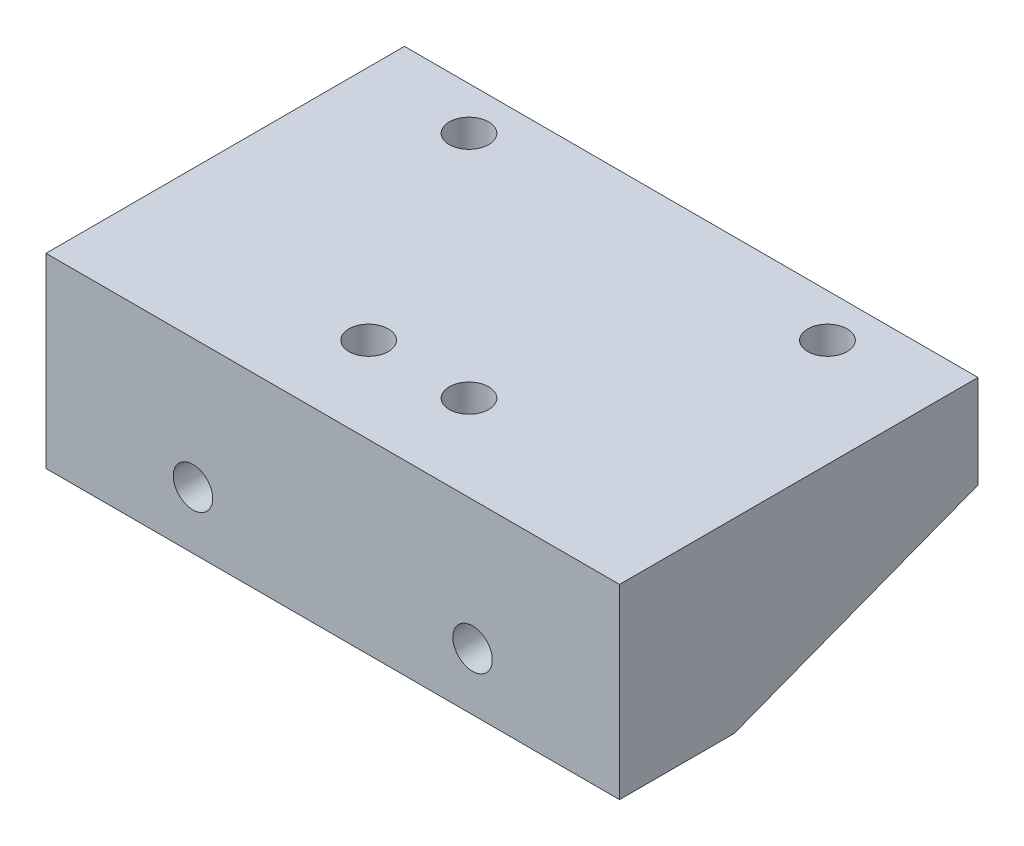
from build123d import *

# Parameters (mm, degrees)
SKETCH1_W                = 62
SKETCH1_H                = 26
BOSS_EXTRUDE1_DEPTH      = 6
SKETCH2_W                = 80
SKETCH2_H                = 10
BOSS_EXTRUDE2_DEPTH      = 50
M5_CLEARANCE_HOLE1_D     = 5.5
M5_CLEARANCE_HOLE1_DEPTH = 10
M5_CLEARANCE_HOLE1_TIP   = 1.652366702
BOSS_EXTRUDE3_DEPTH      = 9
BOSS_EXTRUDE4_START      = -80
BOSS_EXTRUDE4_DEPTH      = 9
M5_CLEARANCE_HOLE2_D     = 5.5
M5_CLEARANCE_HOLE2_DEPTH = 10
M5_CLEARANCE_HOLE2_TIP   = 1.652366702
FILLET1_R                = 3.5
FILLET2_R                = 1


with BuildPart() as part:
    # Sketch1 → Boss-Extrude1 (new body)
    with BuildSketch(Plane.XY):
        with Locations((31, 13)):
            Rectangle(SKETCH1_W, SKETCH1_H)
    extrude(amount=BOSS_EXTRUDE1_DEPTH)

    # Sketch2 → Boss-Extrude2 (add)
    with BuildSketch(Plane.XY.offset(6)):
        with Locations((31, 21)):
            Rectangle(SKETCH2_W, SKETCH2_H)
    extrude(amount=-BOSS_EXTRUDE2_DEPTH)

    # M5 Clearance Hole1
    with Locations(Plane(origin=(0, 0, 0), x_dir=(-1, 0, 0), z_dir=(0, 0, -1))):
        with Locations((-50.5, 8), (-11.5, 8)):
            Hole(M5_CLEARANCE_HOLE1_D / 2, depth=M5_CLEARANCE_HOLE1_DEPTH)
            with Locations((0, 0, -(M5_CLEARANCE_HOLE1_DEPTH + M5_CLEARANCE_HOLE1_TIP / 2))):  # 118° drill point
                Cone(0, M5_CLEARANCE_HOLE1_D / 2, M5_CLEARANCE_HOLE1_TIP, mode=Mode.SUBTRACT)

    # Sketch5 → Boss-Extrude3 (add)
    with BuildSketch(Plane(origin=(71, 0, 0), x_dir=(0, 0, -1), z_dir=(1, 0, 0))):
        Polygon((-6, 0), (10, 0), (44, 13), (44, 16), (-6, 16), align=None)
    extrude(amount=-BOSS_EXTRUDE3_DEPTH)

    # Sketch5<2> → Boss-Extrude4 (add)
    with BuildSketch(Plane(origin=(71, 0, 0), x_dir=(0, 0, -1), z_dir=(1, 0, 0)).offset(BOSS_EXTRUDE4_START)):
        Polygon((-6, 0), (10, 0), (44, 13), (44, 16), (-6, 16), align=None)
    extrude(amount=BOSS_EXTRUDE4_DEPTH)

    # M5 Clearance Hole2
    with Locations(Plane(origin=(0, 16, 0), x_dir=(-1, 0, 0), z_dir=(0, -1, 0))):
        with Locations((-38, 6), (-24, 6), (-56, 38), (-6, 38)):
            Hole(M5_CLEARANCE_HOLE2_D / 2, depth=M5_CLEARANCE_HOLE2_DEPTH)
            with Locations((0, 0, -(M5_CLEARANCE_HOLE2_DEPTH + M5_CLEARANCE_HOLE2_TIP / 2))):  # 118° drill point
                Cone(0, M5_CLEARANCE_HOLE2_D / 2, M5_CLEARANCE_HOLE2_TIP, mode=Mode.SUBTRACT)

    # Fillet1
    fillet1_edges = [part.edges().sort_by_distance(p)[0] for p in [
        (0, 8, 0),
        (62, 8, 0),
    ]]
    fillet(fillet1_edges, radius=FILLET1_R)

    # Fillet2
    fillet2_edges = [part.edges().sort_by_distance(p)[0] for p in [
        (0, 16, -23.75),
        (31, 16, 0),
        (1.025126266, 16, -1.025126266),
        (60.974873734, 16, -1.025126266),
        (62, 16, -23.75),
    ]]
    fillet(fillet2_edges, radius=FILLET2_R)


solid = part.part
